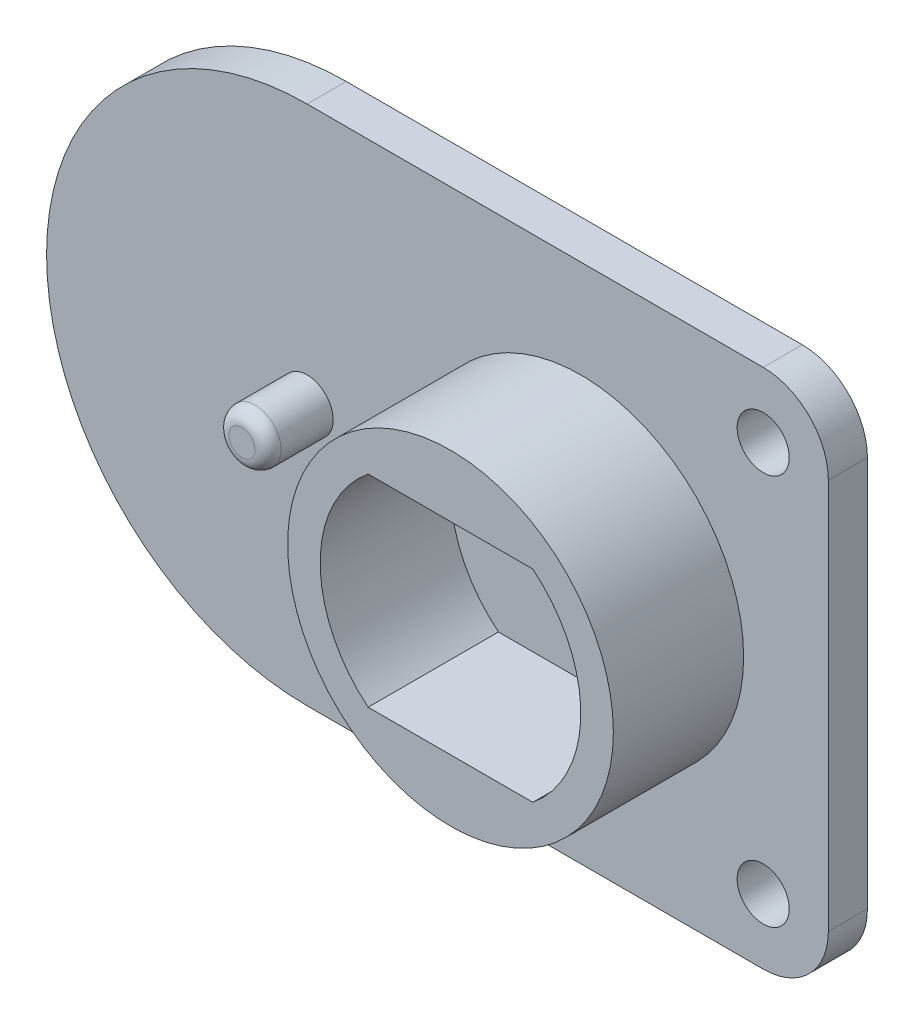
from build123d import *

# Parameters (mm, degrees)
SKIZZE1_R                       = 3.5
SKIZZE1_R_2                     = 1
SKIZZE1_R_3                     = 2
AUFSATZ_LINEAR_AUSTRAGEN1_DEPTH = 3
VERRUNDUNG1_R                   = 5
SKIZZE2_R                       = 12.5
SKIZZE2_R_2                     = 10
AUFSATZ_LINEAR_AUSTRAGEN2_DEPTH = 10
SKIZZE3_R                       = 2
AUFSATZ_LINEAR_AUSTRAGEN3_DEPTH = 5
VERRUNDUNG2_R                   = 1


with BuildPart() as part:
    # Skizze1 → Aufsatz-Linear austragen1 (new body)
    with BuildSketch(Plane.XY):
        with BuildLine():
            ThreePointArc((0, 20), (-20, 0), (0, -20))
            Line((0, -20), (40, -20))
            Line((40, -20), (40, 20))
            Line((40, 20), (0, 20))
        make_face()
        with Locations((21, 0)):
            Circle(SKIZZE1_R, mode=Mode.SUBTRACT)
        Circle(SKIZZE1_R_2, mode=Mode.SUBTRACT)
        with Locations((35, 15)):
            Circle(SKIZZE1_R_3, mode=Mode.SUBTRACT)
        with Locations((35, -15)):
            Circle(SKIZZE1_R_3, mode=Mode.SUBTRACT)
    extrude(amount=AUFSATZ_LINEAR_AUSTRAGEN1_DEPTH)

    # Verrundung1
    verrundung1_edges = [part.edges().sort_by_distance(p)[0] for p in [
        (40, 20, 1.5),
        (40, -20, 1.5),
    ]]
    fillet(verrundung1_edges, radius=VERRUNDUNG1_R)

    # Skizze2 → Aufsatz-Linear austragen2 (add)
    # profile 1 of 3: a face of its own
    with BuildSketch(Plane.XY.offset(3)):
        with Locations((21, 0)):
            Circle(SKIZZE2_R)
        with Locations((21, 0)):
            Circle(SKIZZE2_R_2, mode=Mode.SUBTRACT)
    # profile 2 of 3: a face of its own
    with BuildSketch(Plane.XY.offset(3)):
        with BuildLine():
            Line((21, -7.75), (14.68038767, -7.75))
            ThreePointArc((14.68038767, -7.75), (21, -10), (27.31961233, -7.75))
            Line((27.31961233, -7.75), (21, -7.75))
        make_face()
    # profile 3 of 3: a face of its own
    with BuildSketch(Plane.XY.offset(3)):
        with BuildLine():
            ThreePointArc((27.31961233, 7.75), (21, 10), (14.68038767, 7.75))
            Line((14.68038767, 7.75), (21, 7.75))
            Line((21, 7.75), (27.31961233, 7.75))
        make_face()
    extrude(amount=AUFSATZ_LINEAR_AUSTRAGEN2_DEPTH)

    # Skizze3 → Aufsatz-Linear austragen3 (add)
    with BuildSketch(Plane.XY.offset(3)):
        Circle(SKIZZE3_R)
    extrude(amount=AUFSATZ_LINEAR_AUSTRAGEN3_DEPTH)

    # Verrundung2
    verrundung2_edges = [part.edges().sort_by_distance(p)[0] for p in [
        (-2, 0, 8),
    ]]
    fillet(verrundung2_edges, radius=VERRUNDUNG2_R)


solid = part.part
